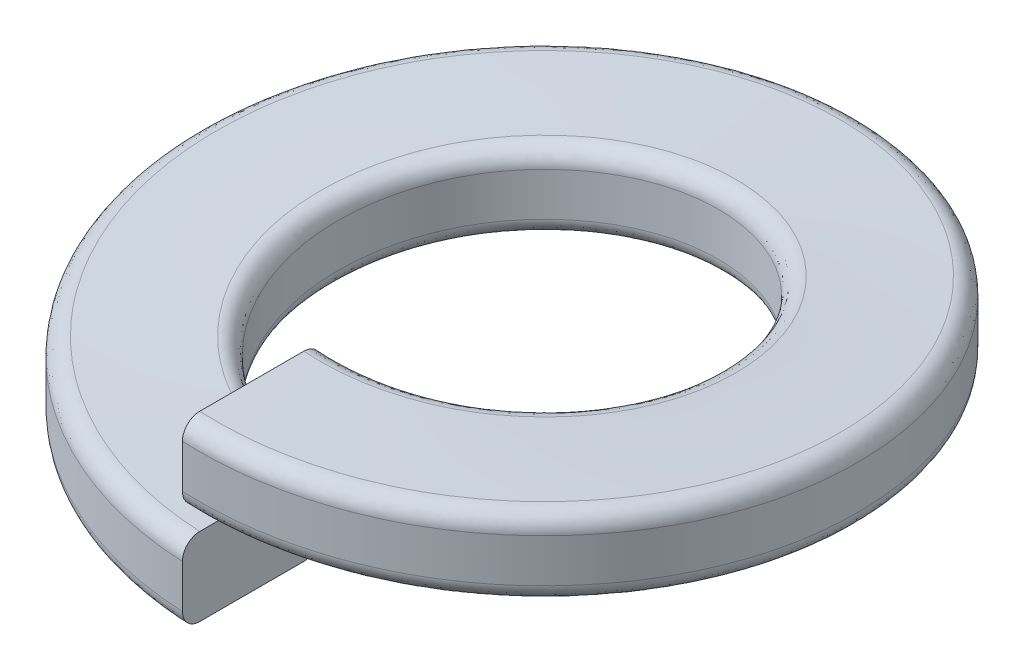
from build123d import *

# Parameters (mm, degrees)
SWEEP1_PITCH  = 1.2
SWEEP1_HEIGHT = 1.2
SWEEP1_RADIUS = 2.2
SKETCH2_W     = 1.6
SKETCH2_H     = 0.9
FILLET1_R     = 0.2


with BuildPart() as part:
    # Sweep1: sweep along a helix
    with BuildLine() as sweep1_path:
        Helix(SWEEP1_PITCH, SWEEP1_HEIGHT, SWEEP1_RADIUS, center=(0, 0, 0), direction=(0, 1, 0), lefthand=True)
    # Sketch2 → Sweep1 (sweep)
    with BuildSketch(Plane(origin=(0, 0, 0), x_dir=(0, 0, -1), z_dir=(1, 0, 0))):
        with Locations((-3, 0.45)):
            Rectangle(SKETCH2_W, SKETCH2_H)
    sweep(path=sweep1_path.line, is_frenet=True)

    # Fillet1
    fillet1_edges = [part.edges().sort_by_distance(p)[0] for p in [
        (0, 0.6, -3.799995909),
        (0, 0.6, -2.199997632),
        (0, 1.5, -2.199997632),
        (0, 1.5, -3.799995909),
    ]]
    fillet(fillet1_edges, radius=FILLET1_R)


solid = part.part
